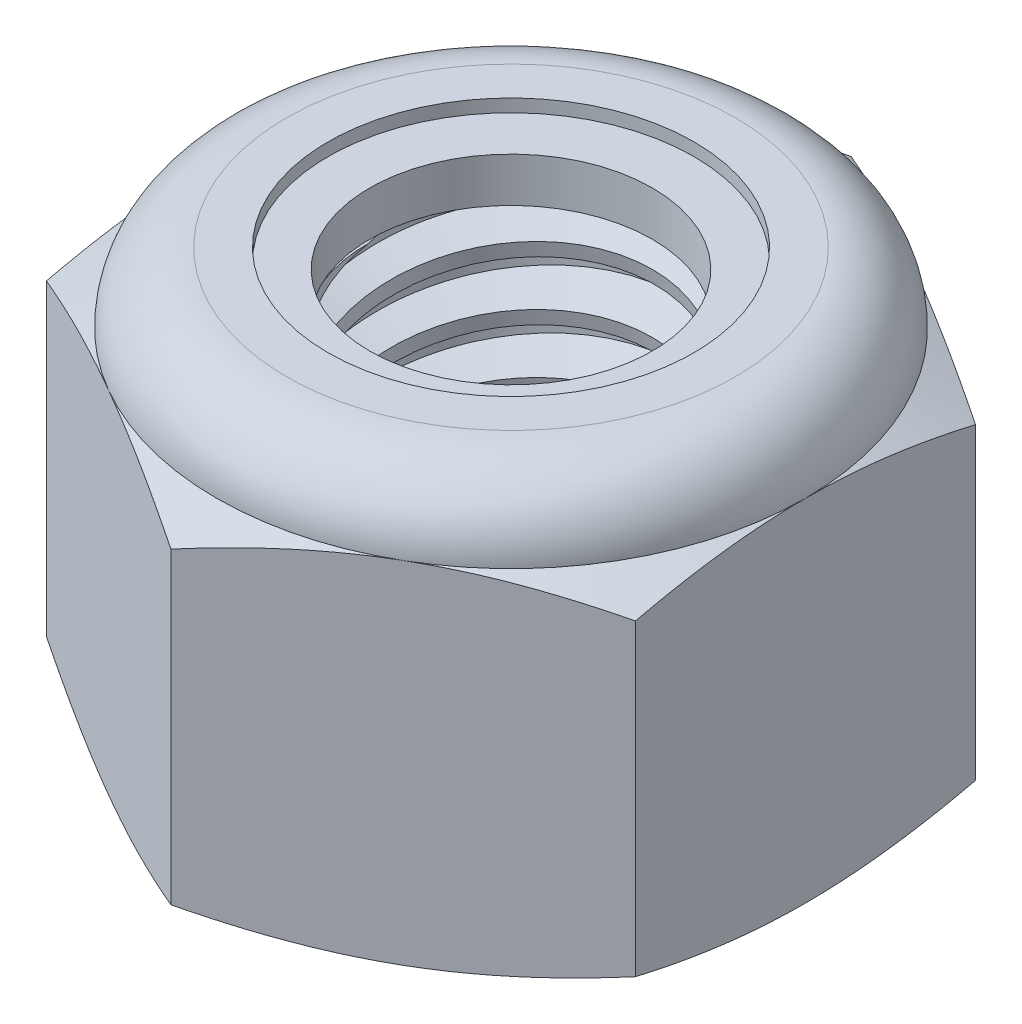
from build123d import *

# Parameters (mm, degrees)
EXTRUDE1_DEPTH      = 5
SKETCH2_W           = 2
SKETCH2_H           = 5
LPATTERN1_COUNT     = 7
LPATTERN1_PITCH     = 0.7
LPATTERN1_COL_COUNT = 2
LPATTERN1_COL_PITCH = 0.7


with BuildPart() as part:
    # Sketch1 → Extrude1 (new body)
    with BuildSketch(Plane(origin=(0, 0, 0), x_dir=(1, 0, 0), z_dir=(0, 1, 0))):
        Polygon((0, 4.041451884), (-3.5, 2.020725942), (-3.5, -2.020725942), (0, -4.041451884), (3.5, -2.020725942), (3.5, 2.020725942), align=None)
    extrude(amount=EXTRUDE1_DEPTH)

    # Sketch4 → Cut-Revolve2 (revolve, cut)
    with BuildSketch(Plane(origin=(0, 0, 0), x_dir=(0, 0, -1), z_dir=(1, 0, 0)), mode=Mode.PRIVATE) as cut_revolve2_sk:
        Polygon((0, 5), (2, 5), (1.679577111, 4.850584353), (1.679577111, 0.149415647), (2, 0), (0, 0), align=None)
    revolve(cut_revolve2_sk.sketch.rotate(Axis((0, 5, 0), (0, 1, 0)), 54.612382926), axis=Axis((0, 5, 0), (0, 1, 0)), mode=Mode.SUBTRACT)


with BuildPart() as body_2:
    # Sketch2 → Revolve1 (revolve)
    with BuildSketch(Plane(origin=(0, 0, 0), x_dir=(0, 0, -1), z_dir=(1, 0, 0))):
        with Locations((1, 2.5)):
            Rectangle(SKETCH2_W, SKETCH2_H)
    revolve(axis=Axis((0, -2, 0), (0, 1, 0)))

    # Sketch3 → Cut-Revolve1 (revolve, cut)
    with BuildSketch(Plane(origin=(0, 0, 0), x_dir=(0, 0, -1), z_dir=(1, 0, 0)), mode=Mode.PRIVATE) as cut_revolve1_sk:
        Polygon((2.015083279, 4.913809834), (2.120666232, 4.310478673), (1.709743669, 4.460641574), (1.679577111, 4.633021905), align=None)
    cut_revolve1 = revolve(cut_revolve1_sk.sketch.rotate(Axis((0, 5, 0.13120342), (0, -0.9850304671557042, -0.17238033175224846)), 180), axis=Axis((0, 5, 0.13120342), (0, -0.9850304671557042, -0.17238033175224846)), mode=Mode.SUBTRACT)

    # LPattern1: Cut-Revolve1 ×7
    with Locations(*[(0, -i * LPATTERN1_PITCH, 0) for i in range(1, LPATTERN1_COUNT)]):
        add(cut_revolve1, mode=Mode.SUBTRACT)

    # LPattern1 col: Cut-Revolve1 ×2
    with Locations(*[(0, i * LPATTERN1_COL_PITCH, 0) for i in range(1, LPATTERN1_COL_COUNT)]):
        add(cut_revolve1, mode=Mode.SUBTRACT)


with BuildPart() as part_1:
    add(part.part)

    # Combine1: cut body 2
    add(body_2.part, mode=Mode.SUBTRACT)

    # Sketch5 → Cut-Revolve3 (revolve, cut)
    with BuildSketch(Plane(origin=(0, 0, 0), x_dir=(0, 0, -1), z_dir=(1, 0, 0)), mode=Mode.PRIVATE) as cut_revolve3_sk:
        with BuildLine():
            Line((0, 0), (3.5, 0))
            Line((3.5, 0), (4.041451884, 0.25248316))
            Line((4.041451884, 0.25248316), (4.041451884, 3.914183506))
            Line((4.041451884, 3.914183506), (3.5, 4.166666667))
            ThreePointArc((3.5, 4.166666667), (3.255922318, 4.755922318), (2.666666667, 5))
            Line((2.666666667, 5), (2.666666667, 6.27))
            Line((2.666666667, 6.27), (5.311451884, 6.27))
            Line((5.311451884, 6.27), (5.311451884, -1.27))
            Line((5.311451884, -1.27), (0, -1.27))
            Line((0, -1.27), (0, 0))
        make_face()
    revolve(cut_revolve3_sk.sketch.rotate(Axis((0, 0, 0), (0, 1, 0)), 54.612382926), axis=Axis((0, 0, 0), (0, 1, 0)), mode=Mode.SUBTRACT)

    # Sketch6 → Cut-Revolve4 (revolve, cut)
    with BuildSketch(Plane(origin=(0, 0, 0), x_dir=(0, 0, -1), z_dir=(1, 0, 0)), mode=Mode.PRIVATE) as cut_revolve4_sk:
        with BuildLine():
            Line((0, 4.166666667), (3.3476, 4.166666667))
            ThreePointArc((3.3476, 4.166666667), (3.148159244, 4.648159244), (2.666666667, 4.8476))
            Line((2.666666667, 4.8476), (2.173121889, 4.8476))
            Line((2.173121889, 4.8476), (2.173121889, 6.27))
            Line((2.173121889, 6.27), (0, 6.27))
            Line((0, 6.27), (0, 4.166666667))
        make_face()
    revolve(cut_revolve4_sk.sketch.rotate(Axis((0, 6.27, 0), (0, 1, 0)), 54.612382926), axis=Axis((0, 6.27, 0), (0, 1, 0)), mode=Mode.SUBTRACT)


with BuildPart() as body_2_2:
    # Sketch7 → Revolve2 (revolve)
    with BuildSketch(Plane(origin=(0, 0, 0), x_dir=(0, 0, -1), z_dir=(1, 0, 0))):
        with BuildLine():
            Line((1.679577111, 4.242866667), (3.266579964, 4.242866667))
            ThreePointArc((3.266579964, 4.242866667), (3.066430175, 4.620419399), (2.666666667, 4.7714))
            Line((2.666666667, 4.7714), (1.679577111, 4.7714))
            Line((1.679577111, 4.7714), (1.679577111, 4.242866667))
        make_face()
    revolve(axis=Axis((0, 4.242866667, 0), (0, 1, 0)))


solid = Compound([part_1.part, body_2_2.part])
